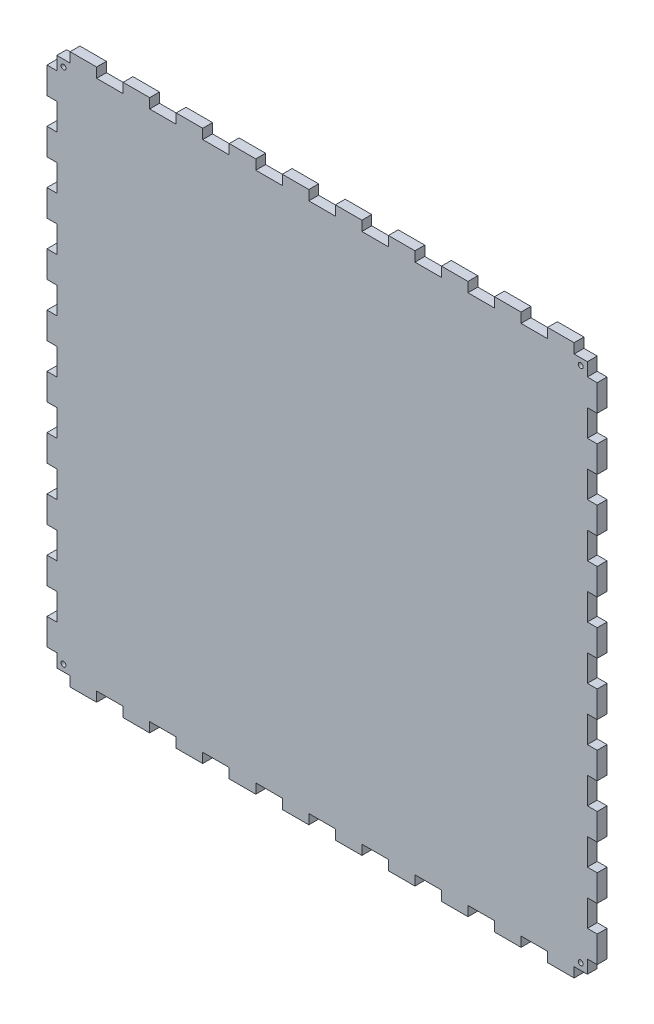
from build123d import *

# Parameters (mm, degrees)
SKETCH1_R           = 1.5875
BOSS_EXTRUDE1_DEPTH = 6.35


with BuildPart() as part:
    # Sketch1 → Boss-Extrude1 (new body)
    with BuildSketch(Plane.XY):
        Polygon((6.35, 349.25), (14.9225, 349.25), (14.9225, 355.6), (32.0675, 355.6), (32.0675, 349.25), (49.2125, 349.25), (49.2125, 355.6), (66.3575, 355.6), (66.3575, 349.25), (83.5025, 349.25), (83.5025, 355.6), (100.6475, 355.6), (100.6475, 349.25), (117.7925, 349.25), (117.7925, 355.6), (134.9375, 355.6), (134.9375, 349.25), (152.0825, 349.25), (152.0825, 355.6), (169.2275, 355.6), (169.2275, 349.25), (186.3725, 349.25), (186.3725, 355.6), (203.5175, 355.6), (203.5175, 349.25), (220.6625, 349.25), (220.6625, 355.6), (237.8075, 355.6), (237.8075, 349.25), (254.9525, 349.25), (254.9525, 355.6), (272.0975, 355.6), (272.0975, 349.25), (289.2425, 349.25), (289.2425, 355.6), (306.3875, 355.6), (306.3875, 349.25), (323.5325, 349.25), (323.5325, 355.6), (340.6775, 355.6), (340.6775, 349.25), (349.25, 349.25), (349.25, 340.6775), (355.6, 340.6775), (355.6, 323.5325), (349.25, 323.5325), (349.25, 306.3875), (355.6, 306.3875), (355.6, 289.2425), (349.25, 289.2425), (349.25, 272.0975), (355.6, 272.0975), (355.6, 254.9525), (349.25, 254.9525), (349.25, 237.8075), (355.6, 237.8075), (355.6, 220.6625), (349.25, 220.6625), (349.25, 203.5175), (355.6, 203.5175), (355.6, 186.3725), (349.25, 186.3725), (349.25, 169.2275), (355.6, 169.2275), (355.6, 152.0825), (349.25, 152.0825), (349.25, 134.9375), (355.6, 134.9375), (355.6, 117.7925), (349.25, 117.7925), (349.25, 100.6475), (355.6, 100.6475), (355.6, 83.5025), (349.25, 83.5025), (349.25, 66.3575), (355.6, 66.3575), (355.6, 49.2125), (349.25, 49.2125), (349.25, 32.0675), (355.6, 32.0675), (355.6, 14.9225), (349.25, 14.9225), (349.25, 6.35), (340.6775, 6.35), (340.6775, 0), (323.5325, 0), (323.5325, 6.35), (306.3875, 6.35), (306.3875, 0), (289.2425, 0), (289.2425, 6.35), (272.0975, 6.35), (272.0975, 0), (254.9525, 0), (254.9525, 6.35), (237.8075, 6.35), (237.8075, 0), (220.6625, 0), (220.6625, 6.35), (203.5175, 6.35), (203.5175, 0), (186.3725, 0), (186.3725, 6.35), (169.2275, 6.35), (169.2275, 0), (152.0825, 0), (152.0825, 6.35), (134.9375, 6.35), (134.9375, 0), (117.7925, 0), (117.7925, 6.35), (100.6475, 6.35), (100.6475, 0), (83.5025, 0), (83.5025, 6.35), (66.3575, 6.35), (66.3575, 0), (49.2125, 0), (49.2125, 6.35), (32.0675, 6.35), (32.0675, 0), (14.9225, 0), (14.9225, 6.35), (6.35, 6.35), (6.35, 14.9225), (0, 14.9225), (0, 32.0675), (6.35, 32.0675), (6.35, 49.2125), (0, 49.2125), (0, 66.3575), (6.35, 66.3575), (6.35, 83.5025), (0, 83.5025), (0, 100.6475), (6.35, 100.6475), (6.35, 117.7925), (0, 117.7925), (0, 134.9375), (6.35, 134.9375), (6.35, 152.0825), (0, 152.0825), (0, 169.2275), (6.35, 169.2275), (6.35, 186.3725), (0, 186.3725), (0, 203.5175), (6.35, 203.5175), (6.35, 220.6625), (0, 220.6625), (0, 237.8075), (6.35, 237.8075), (6.35, 254.9525), (0, 254.9525), (0, 272.0975), (6.35, 272.0975), (6.35, 289.2425), (0, 289.2425), (0, 306.3875), (6.35, 306.3875), (6.35, 323.5325), (0, 323.5325), (0, 340.6775), (6.35, 340.6775), align=None)
        with Locations((10.668, 344.932)):
            Circle(SKETCH1_R, mode=Mode.SUBTRACT)
        with Locations((344.932, 344.932)):
            Circle(SKETCH1_R, mode=Mode.SUBTRACT)
        with Locations((344.932, 10.668)):
            Circle(SKETCH1_R, mode=Mode.SUBTRACT)
        with Locations((10.668, 10.668)):
            Circle(SKETCH1_R, mode=Mode.SUBTRACT)
    extrude(amount=BOSS_EXTRUDE1_DEPTH)


solid = part.part
